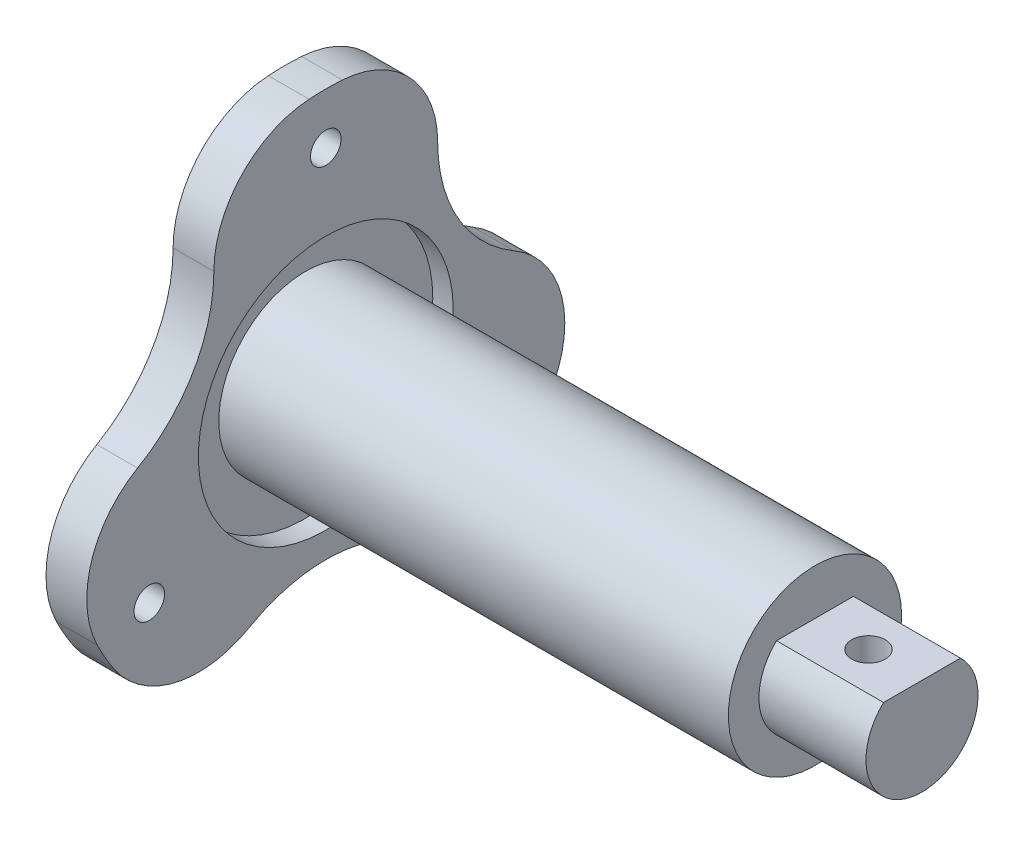
from build123d import *

# Parameters (mm, degrees)
SKETCH_1_R               = 25
EXTRUDE_1_DEPTH          = 3
CUT_EXTRUDE_START        = -3
CUT_EXTRUDE_1_DEPTH      = 3
PATTERN_CIRCULAR_1_COUNT = 3
FILLET_1_R               = 10
SKETCH_3_R               = 8.5
EXTRUDE_2_DEPTH          = 48
SKETCH_5_R               = 1.5
CUT_EXTRUDE_2_DEPTH      = 52
PATTERN_CIRCULAR_2_COUNT = 3
SKETCH_7_R               = 5.5
EXTRUDE_3_DEPTH          = 10.5
SKETCH_8_W               = 10.294353596
SKETCH_8_H               = 3.679030571
CUT_EXTRUDE_3_DEPTH      = 10.5
CUT_EXTRUDE_START_2      = -2
SKETCH_12_R              = 12.5
SKETCH_12_R_2            = 8.5
CUT_EXTRUDE_6_DEPTH      = 2
EXTRUDE_START            = 1
SKETCH_13_R              = 1.5
EXTRUDE_4_DEPTH          = 1
HOLE_WIZARD_M4_1_D       = 3.3


with BuildPart() as part:
    # 草图1 → 凸台-拉伸1 (new body)
    with BuildSketch(Plane(origin=(0, 0, 0), x_dir=(0, 0, -1), z_dir=(1, 0, 0))):
        Circle(SKETCH_1_R)
    extrude(amount=EXTRUDE_1_DEPTH)

    # 草图2 → 切除-拉伸1 (cut)
    with BuildSketch(Plane(origin=(3, 0, 0), x_dir=(0, 0, -1), z_dir=(1, 0, 0)).offset(CUT_EXTRUDE_START)):
        with BuildLine():
            ThreePointArc((24.999979393, 0.032098836), (24.143986785, 6.485977345), (21.650635095, 12.5))
            Line((21.650635095, 12.5), (12.990381057, 7.5))
            ThreePointArc((12.990381057, 7.5), (18.059856782, 2.261897365), (24.999979393, 0.032098836))
        make_face()
        with BuildLine():
            ThreePointArc((12.527788104, 21.634567831), (17.689014542, 17.666317232), (21.650635095, 12.5))
            ThreePointArc((21.650635095, 12.5), (24.143986785, 6.485977345), (24.999979393, 0.032098836))
            ThreePointArc((24.999979393, 0.032098836), (36.234743272, 4.052129412), (40.980762114, 15))
            ThreePointArc((40.980762114, 15), (29.387034993, 29.608124625), (12.527788104, 21.634567831))
        make_face()
        with BuildLine():
            Line((12.990381057, 7.5), (21.650635095, 12.5))
            ThreePointArc((21.650635095, 12.5), (17.689014542, 17.666317232), (12.527788104, 21.634567831))
            ThreePointArc((12.527788104, 21.634567831), (10.98878897, 14.509346079), (12.990381057, 7.5))
        make_face()
    cut_extrude_1 = extrude(amount=CUT_EXTRUDE_1_DEPTH, mode=Mode.SUBTRACT)

    # 阵列(圆周)1: 切除-拉伸1 ×3 about axis
    pattern_circular_1_axis = Axis((0, 0, 0), (1, 0, 0))
    for i in range(1, PATTERN_CIRCULAR_1_COUNT):
        add(cut_extrude_1.rotate(pattern_circular_1_axis, i * 360 / PATTERN_CIRCULAR_1_COUNT), mode=Mode.SUBTRACT)

    # 圆角1
    fillet_1_edges = [part.edges().sort_by_distance(p)[0] for p in [
        (1.5, 0.032098836, 24.999979393),
        (1.5, 21.634567831, 12.527788104),
        (1.5, -21.666666667, -12.472191289),
        (1.5, -21.666666667, 12.472191289),
        (1.5, 21.634567831, -12.527788104),
        (1.5, 0.032098836, -24.999979393),
    ]]
    fillet(fillet_1_edges, radius=FILLET_1_R)

    # 草图3 → 凸台-拉伸2 (add)
    with BuildSketch(Plane(origin=(3, 0, 0), x_dir=(0, 0, -1), z_dir=(1, 0, 0))):
        Circle(SKETCH_3_R)
    extrude(amount=EXTRUDE_2_DEPTH)

    # 草图5 → 切除-拉伸2 (cut)
    with BuildSketch(Plane.ZY):
        with Locations((0, 20)):
            Circle(SKETCH_5_R)
    cut_extrude_2 = extrude(amount=-CUT_EXTRUDE_2_DEPTH, mode=Mode.SUBTRACT)

    # 阵列(圆周)2: 切除-拉伸2 ×3 about axis
    pattern_circular_2_axis = Axis((0, 0, 0), (1, 0, 0))
    for i in range(1, PATTERN_CIRCULAR_2_COUNT):
        add(cut_extrude_2.rotate(pattern_circular_2_axis, i * 360 / PATTERN_CIRCULAR_2_COUNT), mode=Mode.SUBTRACT)

    # 草图7 → 凸台-拉伸3 (add)
    with BuildSketch(Plane(origin=(51, 0, 0), x_dir=(0, 0, -1), z_dir=(1, 0, 0))):
        with Locations(Location((0, 0, 0), (0, 0, 180))):
            Circle(SKETCH_7_R)
    extrude(amount=EXTRUDE_3_DEPTH)

    # 草图8 → 切除-拉伸3 (cut)
    with BuildSketch(Plane(origin=(61.5, 0, 0), x_dir=(0, 0, -1), z_dir=(1, 0, 0))):
        with Locations((0, 5.839515286)):
            Rectangle(SKETCH_8_W, SKETCH_8_H)
    extrude(amount=-CUT_EXTRUDE_3_DEPTH, mode=Mode.SUBTRACT)

    # 草图12 → 切除-拉伸6 (cut)
    with BuildSketch(Plane(origin=(3, 0, 0), x_dir=(0, 0, -1), z_dir=(1, 0, 0)).offset(CUT_EXTRUDE_START_2)):
        Circle(SKETCH_12_R)
        Circle(SKETCH_12_R_2, mode=Mode.SUBTRACT)
    extrude(amount=CUT_EXTRUDE_6_DEPTH, mode=Mode.SUBTRACT)

    # 草图13 → 凸台-拉伸4 (add)
    with BuildSketch(Plane.ZY.offset(EXTRUDE_START)):
        with BuildLine():
            ThreePointArc((-18.464089251, 2.019259302), (-12.990381057, 7.5), (-10.980774478, 14.980740698))
            ThreePointArc((-10.980774478, 14.980740698), (-8.274973062, 21.808572714), (-1.634637867, 24.94650194))
            ThreePointArc((-1.634637867, 24.94650194), (0, 25), (1.634637867, 24.94650194))
            ThreePointArc((1.634637867, 24.94650194), (8.274973062, 21.808572714), (10.980774478, 14.980740698))
            ThreePointArc((10.980774478, 14.980740698), (12.990381057, 7.5), (18.464089251, 2.019259302))
            ThreePointArc((18.464089251, 2.019259302), (23.024264522, -3.737949469), (22.421623349, -11.057613051))
            ThreePointArc((22.421623349, -11.057613051), (21.650635095, -12.5), (20.786985482, -13.888888889))
            ThreePointArc((20.786985482, -13.888888889), (14.749291459, -18.070623245), (7.483314774, -17))
            ThreePointArc((7.483314774, -17), (0, -15), (-7.483314774, -17))
            ThreePointArc((-7.483314774, -17), (-14.749291459, -18.070623245), (-20.786985482, -13.888888889))
            ThreePointArc((-20.786985482, -13.888888889), (-21.650635095, -12.5), (-22.421623349, -11.057613051))
            ThreePointArc((-22.421623349, -11.057613051), (-23.024264522, -3.737949469), (-18.464089251, 2.019259302))
        make_face()
        with Locations((0, 20)):
            Circle(SKETCH_13_R, mode=Mode.SUBTRACT)
        with Locations((-17.320508076, -10)):
            Circle(SKETCH_13_R, mode=Mode.SUBTRACT)
        with Locations((17.320508076, -10)):
            Circle(SKETCH_13_R, mode=Mode.SUBTRACT)
    extrude(amount=-EXTRUDE_4_DEPTH)

    # M4 螺纹孔1 (through all)
    with Locations(Plane(origin=(0, 4, 0), x_dir=(1, 0, 0), z_dir=(0, 1, 0))):
        with Locations((56.25, 0)):
            Hole(HOLE_WIZARD_M4_1_D / 2)


solid = part.part
